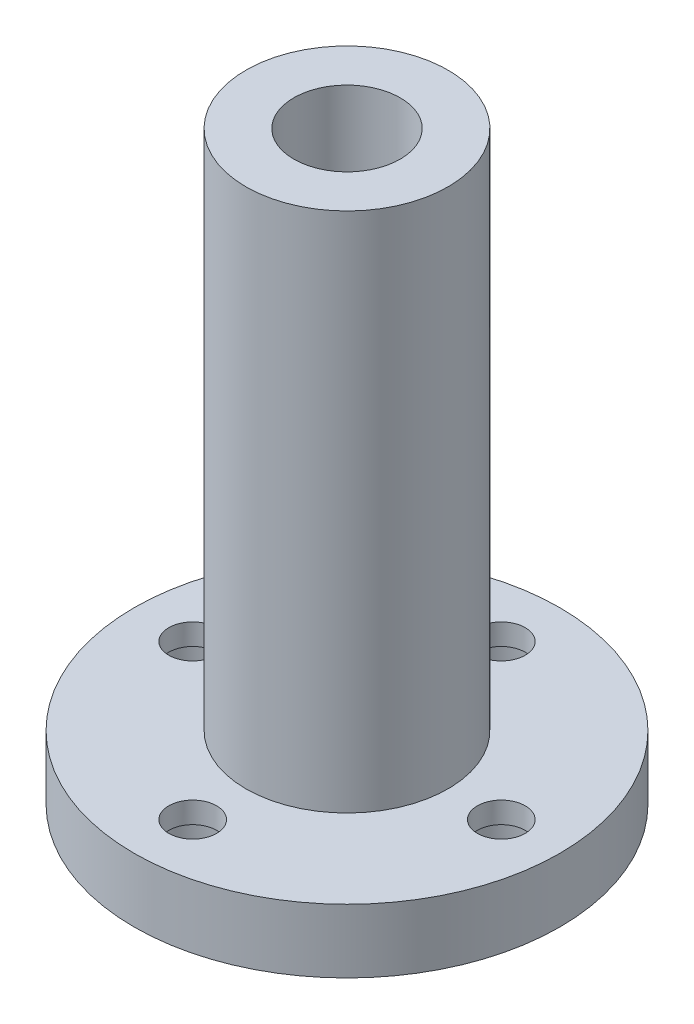
from build123d import *

# Parameters (mm, degrees)
SKETCH_2_R          = 2.25
CUT_EXTRUDE_1_DEPTH = 57.577380639
SKETCH_3_R          = 3.75
CUT_EXTRUDE_2_DEPTH = 4


with BuildPart() as part:
    # Эскиз1 → Повернуть1 (revolve)
    with BuildSketch(Plane.XY, mode=Mode.PRIVATE) as revolve_1_sk:
        Polygon((5, 55), (5, 0), (20, 0), (20, 6), (9.5, 6), (9.5, 55), align=None)
    revolve(revolve_1_sk.sketch.rotate(Axis((0, 53.580953173, 0), (0, -1, 0)), 90), axis=Axis((0, 53.580953173, 0), (0, -1, 0)))

    # Эскиз2 → Вырез-Вытянуть1 (cut, through all)
    with BuildSketch(Plane(origin=(0, 6, 0), x_dir=(1, 0, 0), z_dir=(0, 1, 0))):
        with Locations(Location((14.5, 0, 0), (0, 0, 270))):
            Circle(SKETCH_2_R)
        with Locations(Location((0, -14.5, 0), (0, 0, 270))):
            Circle(SKETCH_2_R)
        with Locations(Location((-14.5, 0, 0), (0, 0, 270))):
            Circle(SKETCH_2_R)
        with Locations(Location((0, 14.5, 0), (0, 0, 270))):
            Circle(SKETCH_2_R)
    extrude(amount=-CUT_EXTRUDE_1_DEPTH, mode=Mode.SUBTRACT)

    # Эскиз3 → Вырез-Вытянуть2 (cut)
    with BuildSketch(Plane.XZ):
        with Locations(Location((-14.5, 0, 0), (0, 0, 270))):
            Circle(SKETCH_3_R)
        with Locations(Location((0, 14.5, 0), (0, 0, 270))):
            Circle(SKETCH_3_R)
        with Locations(Location((14.5, 0, 0), (0, 0, 270))):
            Circle(SKETCH_3_R)
        with Locations(Location((0, -14.5, 0), (0, 0, 270))):
            Circle(SKETCH_3_R)
    extrude(amount=-CUT_EXTRUDE_2_DEPTH, mode=Mode.SUBTRACT)


solid = part.part
